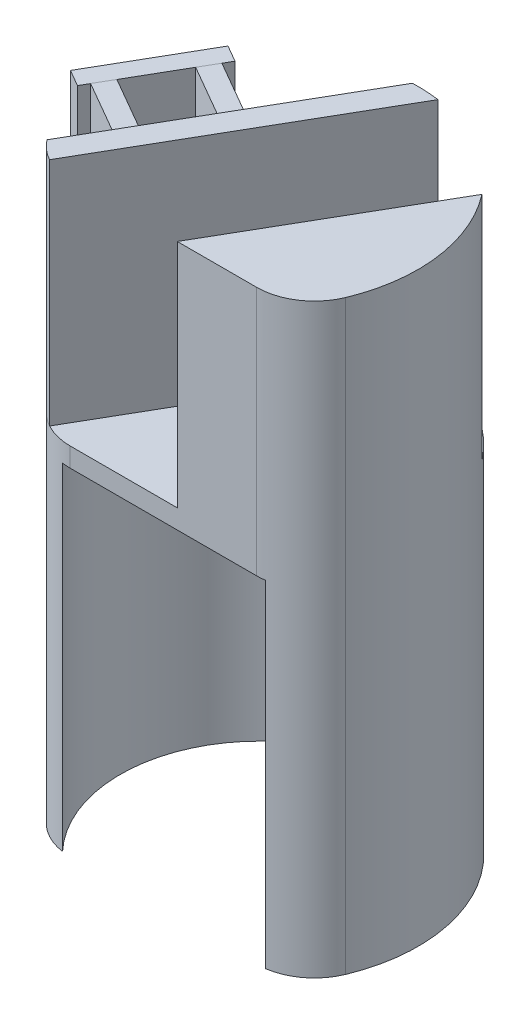
from build123d import *

# Parameters (mm, degrees)
SKETCH_1_R          = 16.5
SKETCH_1_R_2        = 14.5
EXTRUDE_1_DEPTH     = 35
SKETCH_3_R          = 16.5
EXTRUDE_2_DEPTH     = 2
SKETCH_4_W          = 49.747728002
SKETCH_4_H          = 43.690708299
CUT_EXTRUDE_1_DEPTH = 49.40970977
CUT_EXTRUDE_2_REACH = 45.744
SKETCH_5_R          = 3.75
FILLET_1_R          = 6
EXTRUDE_3_DEPTH     = 24
EXTRUDE_3_2_DEPTH   = 24
SKETCH_7_W          = 2
SKETCH_7_H          = 31.142616215
EXTRUDE_4_DEPTH     = 10
EXTRUDE_4_2_DEPTH   = 10
EXTRUDE_5_DEPTH     = 2
EXTRUDE_7_DEPTH     = 24
CUT_EXTRUDE_3_DEPTH = 45.705817321


with BuildPart() as part:
    # 草图1 → 凸台-拉伸1 (new body)
    with BuildSketch(Plane(origin=(0, 0, 0), x_dir=(1, 0, 0), z_dir=(0, 1, 0))):
        with Locations(Location((0, 0, 0), (0, 0, 270))):
            Circle(SKETCH_1_R)
        with Locations(Location((0, 0, 0), (0, 0, 270))):
            Circle(SKETCH_1_R_2, mode=Mode.SUBTRACT)
    extrude(amount=EXTRUDE_1_DEPTH)

    # 草图3 → 凸台-拉伸2 (add)
    with BuildSketch(Plane(origin=(0, 35, 0), x_dir=(1, 0, 0), z_dir=(0, 1, 0))):
        with Locations(Location((0, 0, 0), (0, 0, 270))):
            Circle(SKETCH_3_R)
    extrude(amount=EXTRUDE_2_DEPTH)

    # 草图4 → 切除-拉伸1 (cut, through all)
    with BuildSketch(Plane.XY.offset(10)):
        with Locations((3.540684312, 17.876483266)):
            Rectangle(SKETCH_4_W, SKETCH_4_H)
    extrude(amount=CUT_EXTRUDE_1_DEPTH, mode=Mode.SUBTRACT)

    # 草图5 → 切除-拉伸2 (cut, up to next)
    with BuildSketch(Plane(origin=(0, 37, 0), x_dir=(1, 0, 0), z_dir=(0, 1, 0)), mode=Mode.PRIVATE) as cut_extrude_2_sk1:
        with Locations(Location((0, 0, 0), (0, 0, 270))):
            Circle(SKETCH_5_R)
    cut_extrude_2_tool1 = extrude(cut_extrude_2_sk1.sketch, amount=-CUT_EXTRUDE_2_REACH, mode=Mode.PRIVATE) & part.part
    add(cut_extrude_2_tool1.solids().sort_by_distance((0, 37, 0))[0], mode=Mode.SUBTRACT)

    # 圆角1
    fillet_1_edges = [part.edges().sort_by_distance(p)[0] for p in [
        (13.124404748, 18.5, 10),
        (-13.124404748, 18.5, 10),
    ]]
    fillet(fillet_1_edges, radius=FILLET_1_R)



with BuildPart() as body_2:
    # 草图6 → 凸台-拉伸3 (new body)
    with BuildSketch(Plane(origin=(0, 37, 0), x_dir=(1, 0, 0), z_dir=(0, 1, 0))):
        with BuildLine():
            Line((13.047897801, 10.099621923), (1.443375673, -10))
            Line((1.443375673, -10), (4.330127019, -10))
            Line((4.330127019, -10), (14.5721397, 7.739686335))
            ThreePointArc((14.5721397, 7.739686335), (13.860337004, 8.952153826), (13.047897801, 10.099621923))
        make_face()
    extrude(amount=EXTRUDE_3_DEPTH)


with BuildPart() as body_3:
    # 草图6 → Extrude 3 2 (new body)
    with BuildSketch(Plane(origin=(0, 37, 0), x_dir=(1, 0, 0), z_dir=(0, 1, 0))):
        with BuildLine():
            Line((-0.583304866, 16.489686335), (-14.498767089, -7.612601246))
            ThreePointArc((-14.498767089, -7.612601246), (-13.623792058, -8.546260307), (-12.570735662, -9.273152854))
            Line((-12.570735662, -9.273152854), (2.222580253, 16.349621923))
            ThreePointArc((2.222580253, 16.349621923), (0.82262413, 16.479480864), (-0.583304866, 16.489686335))
        make_face()
    extrude(amount=EXTRUDE_3_2_DEPTH)


with BuildPart() as body_4:
    # 草图7 → 凸台-拉伸4 (new body)
    with BuildSketch(Plane(origin=(-7.577722283, 0, -4.375), x_dir=(-0.5000000000000041, 0, 0.8660254037844364), z_dir=(-0.8660254037844363, 0, -0.500000000000004))):
        with Locations((6.842089612, 42.571308108)):
            Rectangle(SKETCH_7_W, SKETCH_7_H)
    extrude(amount=EXTRUDE_4_DEPTH)

    # 草图8 → 凸台-拉伸5 (add)
    with BuildSketch(Plane(origin=(-16.237976321, 0, -9.375), x_dir=(-0.5000000000000041, 0, 0.8660254037844364), z_dir=(-0.8660254037844364, 0, -0.5000000000000041))):
        Polygon((8.842089612, 58.138003133), (8.842089612, 26.995386917), (-3.157910388, 27), (-3.157910388, 58.142616215), align=None)
    extrude(amount=EXTRUDE_5_DEPTH)


with BuildPart() as body_5:
    # 草图7 → Extrude 4 2 (new body)
    with BuildSketch(Plane(origin=(-7.577722283, 0, -4.375), x_dir=(-0.5000000000000041, 0, 0.8660254037844364), z_dir=(-0.8660254037844363, 0, -0.500000000000004))):
        with Locations((-1.157910388, 42.571308108)):
            Rectangle(SKETCH_7_W, SKETCH_7_H)
    extrude(amount=EXTRUDE_4_2_DEPTH)


with BuildPart() as part_1:
    add(part.part)

    add(body_2.part)  # 凸台-拉伸7 merges body 2
    # 草图9 → 凸台-拉伸7 (add, through all)
    with BuildSketch(Plane(origin=(0, 37, 0), x_dir=(1, 0, 0), z_dir=(0, 1, 0))):
        with BuildLine():
            Line((4.330127019, -10), (9.708243919, -10))
            ThreePointArc((9.708243919, -10), (13.046335761, -8.985693819), (15.255811873, -6.285714286))
            ThreePointArc((15.255811873, -6.285714286), (16.480432015, 0.803343383), (14.5721397, 7.739686335))
            Line((14.5721397, 7.739686335), (4.330127019, -10))
        make_face()
    extrude(amount=EXTRUDE_7_DEPTH)


with BuildPart() as cut_extrude_3_tool:
    # 草图10 → 切除-拉伸3 (new, through all)
    with BuildSketch(Plane.XZ.offset(-35)):
        with BuildLine():
            Line((9.708243919, 10), (-9.708243919, 10))
            ThreePointArc((-9.708243919, 10), (-10.133770704, 9.984891558), (-10.557154474, 9.939642318))
            ThreePointArc((-10.557154474, 9.939642318), (0, -14.5), (10.557154474, 9.939642318))
            ThreePointArc((10.557154474, 9.939642318), (10.133770704, 9.984891558), (9.708243919, 10))
        make_face()
    extrude(amount=CUT_EXTRUDE_3_DEPTH)


with BuildPart() as body_4_1:
    add(body_4.part)

    # 切除-拉伸3: cut by cut_extrude_3_tool
    add(cut_extrude_3_tool.part, mode=Mode.SUBTRACT)


with BuildPart() as body_5_1:
    add(body_5.part)

    # 切除-拉伸3: cut by cut_extrude_3_tool
    add(cut_extrude_3_tool.part, mode=Mode.SUBTRACT)


solid = Compound([body_3.part, part_1.part, body_4_1.part, body_5_1.part])
